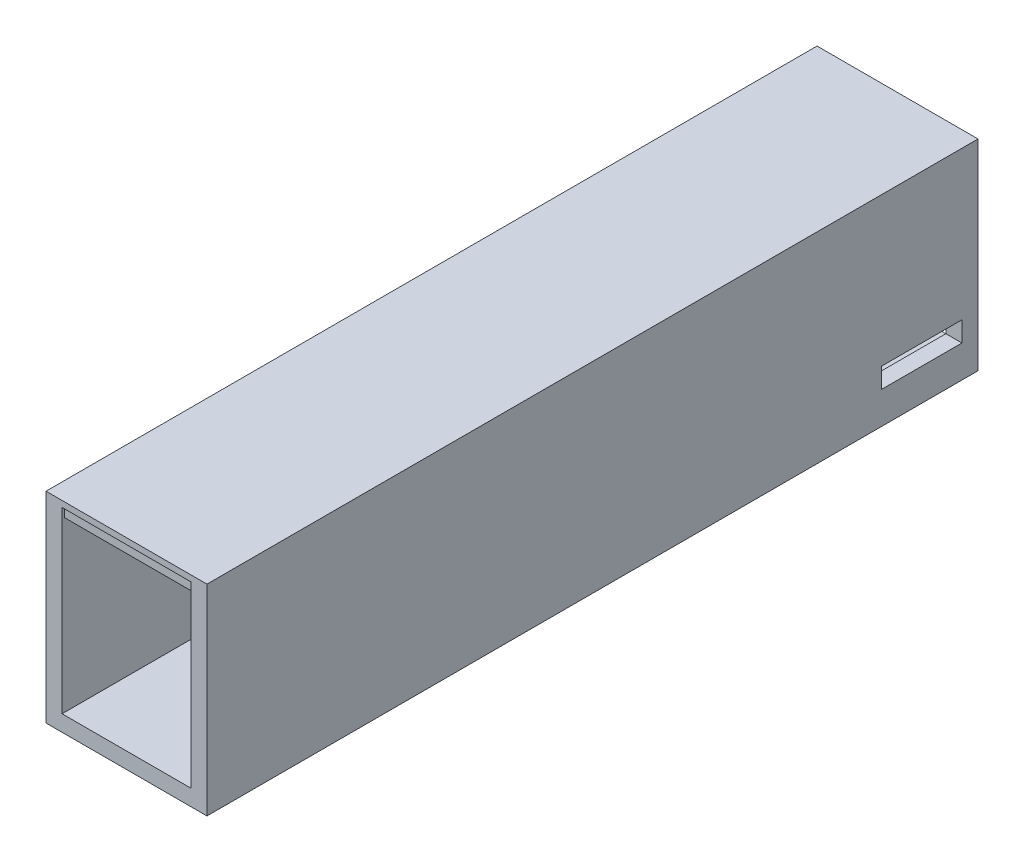
from build123d import *

# Parameters (mm, degrees)
SKETCH2_W               = 200.4
SKETCH2_H               = 250
SKETCH2_W_2             = 160.4
SKETCH2_H_2             = 210
BOSS_EXTRUDE1_DEPTH     = 480
SKETCH3_W               = 160.4
SKETCH3_H               = 25
CUT_EXTRUDE1_DEPTH      = 3
CUT_EXTRUDE2_DEPTH      = 535.282171956
CUT_EXTRUDE2_DEPTH_BACK = 535.282171956
SKETCH4_W               = 100
SKETCH4_H               = 25
SKETCH7_R               = 1.5
CUT_EXTRUDE4_DEPTH      = 20


with BuildPart() as part:
    # Sketch2 → Boss-Extrude1 (new, symmetric)
    with BuildSketch(Plane.XY):
        with Locations((37.499423299, 25.044257703)):
            Rectangle(SKETCH2_W, SKETCH2_H)
        with Locations((37.499423299, 25.044257703)):
            Rectangle(SKETCH2_W_2, SKETCH2_H_2, mode=Mode.SUBTRACT)
    extrude(amount=BOSS_EXTRUDE1_DEPTH, both=True)

    # Sketch3 → Cut-Extrude1 (cut)
    with BuildSketch(Plane.XY.offset(480)):
        with Locations((37.499423299, 130.044257703)):
            Rectangle(SKETCH3_W, SKETCH3_H)
    cut_extrude1 = extrude(amount=-CUT_EXTRUDE1_DEPTH, mode=Mode.SUBTRACT)

    # Mirror1: Cut-Extrude1 across plane
    add(cut_extrude1.mirror(Plane.XY), mode=Mode.SUBTRACT)

    # Sketch4 → Cut-Extrude2 (cut, two sides: drawn at the far end of the back side and taken through both)
    with BuildSketch(Plane(origin=(-42.700576701, 0, 0), x_dir=(0, 0, -1), z_dir=(1, 0, 0)).offset(-CUT_EXTRUDE2_DEPTH_BACK)):
        with Locations((410, -47.455742297)):
            Rectangle(SKETCH4_W, SKETCH4_H)
    extrude(amount=CUT_EXTRUDE2_DEPTH + CUT_EXTRUDE2_DEPTH_BACK, mode=Mode.SUBTRACT)

    # Sketch7 → Cut-Extrude4 (cut)
    with BuildSketch(Plane.XZ.offset(99.955742297)):
        with Locations(Location((112.499423299, 0, 0), (0, 0, 270))):
            Circle(SKETCH7_R)
        with Locations(Location((-37.500576701, 0, 0), (0, 0, 270))):
            Circle(SKETCH7_R)
    extrude(amount=-CUT_EXTRUDE4_DEPTH, mode=Mode.SUBTRACT)


solid = part.part
